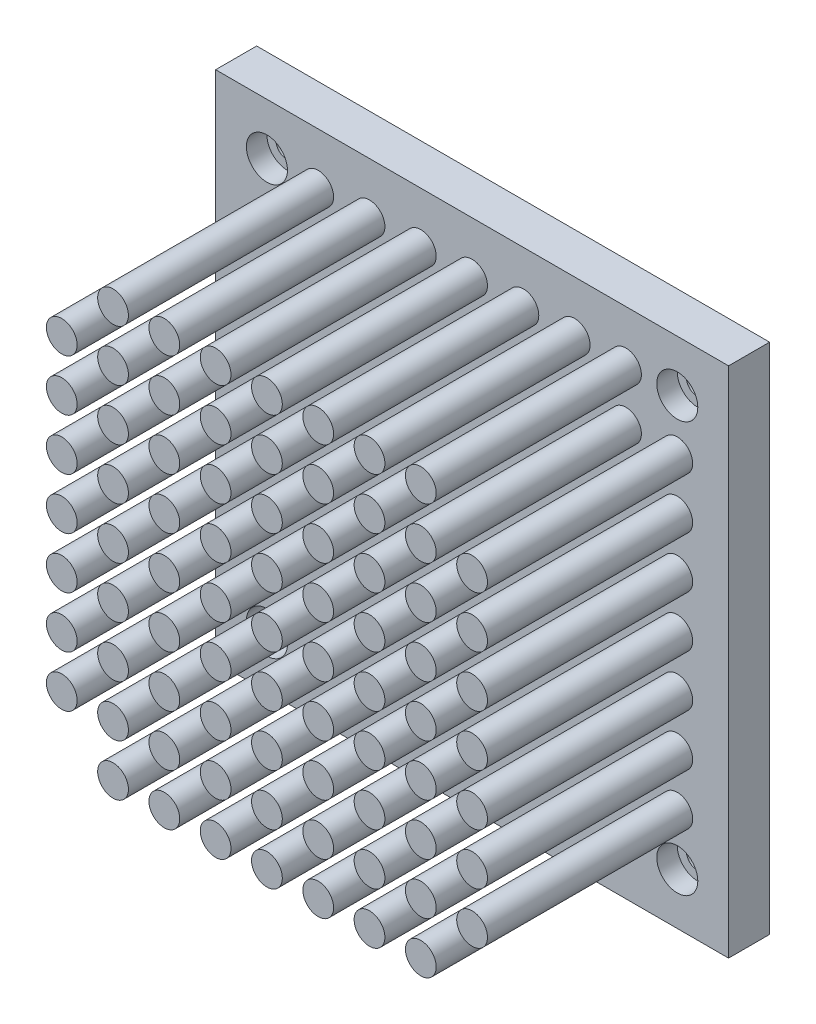
from build123d import *

# Parameters (mm, degrees)
SKETCH_1_W          = 100
SKETCH_1_H          = 100
EXTRUDE_1_DEPTH     = 8
SKETCH_2_W          = 60
SKETCH_2_H          = 60
EXTRUDE_2_DEPTH     = 2
SKETCH_3_R          = 3
EXTRUDE_3_DEPTH     = 40
SKETCH_4_R          = 4
CUT_EXTRUDE_1_DEPTH = 4
SKETCH_5_R          = 2.25
CUT_EXTRUDE_2_DEPTH = 82.240384046


with BuildPart() as part:
    # 草图1 → 凸台-拉伸1 (new body)
    with BuildSketch(Plane.XY):
        Rectangle(SKETCH_1_W, SKETCH_1_H)
    extrude(amount=EXTRUDE_1_DEPTH)

    # 草图2 → 凸台-拉伸2 (add)
    with BuildSketch(Plane.XY):
        Rectangle(SKETCH_2_W, SKETCH_2_H)
    extrude(amount=-EXTRUDE_2_DEPTH)

    # 草图3 → 凸台-拉伸3 (add)
    with BuildSketch(Plane.XY.offset(8)):
        with Locations((-40, -30)):
            Circle(SKETCH_3_R)
        with Locations((-40, -20)):
            Circle(SKETCH_3_R)
        with Locations((-40, -10)):
            Circle(SKETCH_3_R)
        with Locations((-40, 0)):
            Circle(SKETCH_3_R)
        with Locations((-40, 10)):
            Circle(SKETCH_3_R)
        with Locations((-40, 20)):
            Circle(SKETCH_3_R)
        with Locations((-40, 30)):
            Circle(SKETCH_3_R)
        with Locations((-30, -40)):
            Circle(SKETCH_3_R)
        with Locations((-30, -30)):
            Circle(SKETCH_3_R)
        with Locations((-30, -20)):
            Circle(SKETCH_3_R)
        with Locations((-30, -10)):
            Circle(SKETCH_3_R)
        with Locations((-30, 0)):
            Circle(SKETCH_3_R)
        with Locations((-30, 10)):
            Circle(SKETCH_3_R)
        with Locations((-30, 20)):
            Circle(SKETCH_3_R)
        with Locations((-30, 30)):
            Circle(SKETCH_3_R)
        with Locations((-30, 40)):
            Circle(SKETCH_3_R)
        with Locations((-20, -40)):
            Circle(SKETCH_3_R)
        with Locations((-20, -30)):
            Circle(SKETCH_3_R)
        with Locations((-20, -20)):
            Circle(SKETCH_3_R)
        with Locations((-20, -10)):
            Circle(SKETCH_3_R)
        with Locations((-20, 0)):
            Circle(SKETCH_3_R)
        with Locations((-20, 10)):
            Circle(SKETCH_3_R)
        with Locations((-20, 20)):
            Circle(SKETCH_3_R)
        with Locations((-20, 30)):
            Circle(SKETCH_3_R)
        with Locations((-20, 40)):
            Circle(SKETCH_3_R)
        with Locations((-10, -40)):
            Circle(SKETCH_3_R)
        with Locations((-10, -30)):
            Circle(SKETCH_3_R)
        with Locations((-10, -20)):
            Circle(SKETCH_3_R)
        with Locations((-10, -10)):
            Circle(SKETCH_3_R)
        with Locations((-10, 0)):
            Circle(SKETCH_3_R)
        with Locations((-10, 10)):
            Circle(SKETCH_3_R)
        with Locations((-10, 20)):
            Circle(SKETCH_3_R)
        with Locations((-10, 30)):
            Circle(SKETCH_3_R)
        with Locations((-10, 40)):
            Circle(SKETCH_3_R)
        with Locations((0, -40)):
            Circle(SKETCH_3_R)
        with Locations((0, -30)):
            Circle(SKETCH_3_R)
        with Locations((0, -20)):
            Circle(SKETCH_3_R)
        with Locations((0, -10)):
            Circle(SKETCH_3_R)
        Circle(SKETCH_3_R)
        with Locations((0, 10)):
            Circle(SKETCH_3_R)
        with Locations((0, 20)):
            Circle(SKETCH_3_R)
        with Locations((0, 30)):
            Circle(SKETCH_3_R)
        with Locations((0, 40)):
            Circle(SKETCH_3_R)
        with Locations((10, -40)):
            Circle(SKETCH_3_R)
        with Locations((10, -30)):
            Circle(SKETCH_3_R)
        with Locations((10, -20)):
            Circle(SKETCH_3_R)
        with Locations((10, -10)):
            Circle(SKETCH_3_R)
        with Locations((10, 0)):
            Circle(SKETCH_3_R)
        with Locations((10, 10)):
            Circle(SKETCH_3_R)
        with Locations((10, 20)):
            Circle(SKETCH_3_R)
        with Locations((10, 30)):
            Circle(SKETCH_3_R)
        with Locations((10, 40)):
            Circle(SKETCH_3_R)
        with Locations((20, -40)):
            Circle(SKETCH_3_R)
        with Locations((20, -30)):
            Circle(SKETCH_3_R)
        with Locations((20, -20)):
            Circle(SKETCH_3_R)
        with Locations((20, -10)):
            Circle(SKETCH_3_R)
        with Locations((20, 0)):
            Circle(SKETCH_3_R)
        with Locations((20, 10)):
            Circle(SKETCH_3_R)
        with Locations((20, 20)):
            Circle(SKETCH_3_R)
        with Locations((20, 30)):
            Circle(SKETCH_3_R)
        with Locations((20, 40)):
            Circle(SKETCH_3_R)
        with Locations((30, -40)):
            Circle(SKETCH_3_R)
        with Locations((30, -30)):
            Circle(SKETCH_3_R)
        with Locations((30, -20)):
            Circle(SKETCH_3_R)
        with Locations((30, -10)):
            Circle(SKETCH_3_R)
        with Locations((30, 0)):
            Circle(SKETCH_3_R)
        with Locations((30, 10)):
            Circle(SKETCH_3_R)
        with Locations((30, 20)):
            Circle(SKETCH_3_R)
        with Locations((30, 30)):
            Circle(SKETCH_3_R)
        with Locations((30, 40)):
            Circle(SKETCH_3_R)
        with Locations((40, -30)):
            Circle(SKETCH_3_R)
        with Locations((40, -20)):
            Circle(SKETCH_3_R)
        with Locations((40, -10)):
            Circle(SKETCH_3_R)
        with Locations((40, 0)):
            Circle(SKETCH_3_R)
        with Locations((40, 10)):
            Circle(SKETCH_3_R)
        with Locations((40, 20)):
            Circle(SKETCH_3_R)
        with Locations((40, 30)):
            Circle(SKETCH_3_R)
    extrude(amount=EXTRUDE_3_DEPTH)

    # 草图4 → 切除-拉伸1 (cut)
    with BuildSketch(Plane.XY.offset(8)):
        with Locations((-40, -40)):
            Circle(SKETCH_4_R)
        with Locations((-40, 40)):
            Circle(SKETCH_4_R)
        with Locations((40, -40)):
            Circle(SKETCH_4_R)
        with Locations((40, 40)):
            Circle(SKETCH_4_R)
    extrude(amount=-CUT_EXTRUDE_1_DEPTH, mode=Mode.SUBTRACT)

    # 草图5 → 切除-拉伸2 (cut, through all)
    with BuildSketch(Plane.XY.offset(8)):
        with Locations((-40, -40)):
            Circle(SKETCH_5_R)
        with Locations((-40, 40)):
            Circle(SKETCH_5_R)
        with Locations((40, -40)):
            Circle(SKETCH_5_R)
        with Locations((40, 40)):
            Circle(SKETCH_5_R)
    extrude(amount=-CUT_EXTRUDE_2_DEPTH, mode=Mode.SUBTRACT)


solid = part.part
